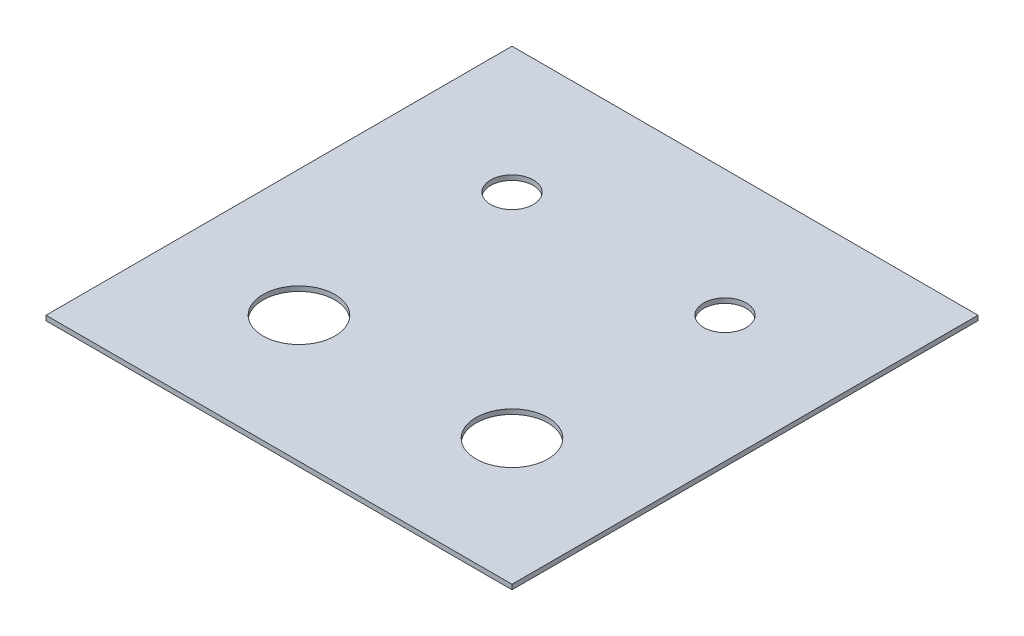
from build123d import *

# Parameters (mm, degrees)
SKETCH1_W           = 44.45
SKETCH1_H           = 44.45
SKETCH1_R           = 2.032
SKETCH1_R_2         = 3.429
BOSS_EXTRUDE1_DEPTH = 0.46


with BuildPart() as part:
    # Sketch1 → Boss-Extrude1 (new body)
    with BuildSketch(Plane(origin=(0, 0, 0), x_dir=(1, 0, 0), z_dir=(0, 1, 0))):
        Rectangle(SKETCH1_W, SKETCH1_H)
        with Locations(Location((-10.16, 10.16, 0), (0, 0, 270))):
            Circle(SKETCH1_R, mode=Mode.SUBTRACT)
        with Locations(Location((10.16, 10.16, 0), (0, 0, 90))):
            Circle(SKETCH1_R, mode=Mode.SUBTRACT)
        with Locations(Location((-10.16, -10.16, 0), (0, 0, 270))):
            Circle(SKETCH1_R_2, mode=Mode.SUBTRACT)
        with Locations(Location((10.16, -10.16, 0), (0, 0, 90))):
            Circle(SKETCH1_R_2, mode=Mode.SUBTRACT)
    extrude(amount=BOSS_EXTRUDE1_DEPTH)


solid = part.part
